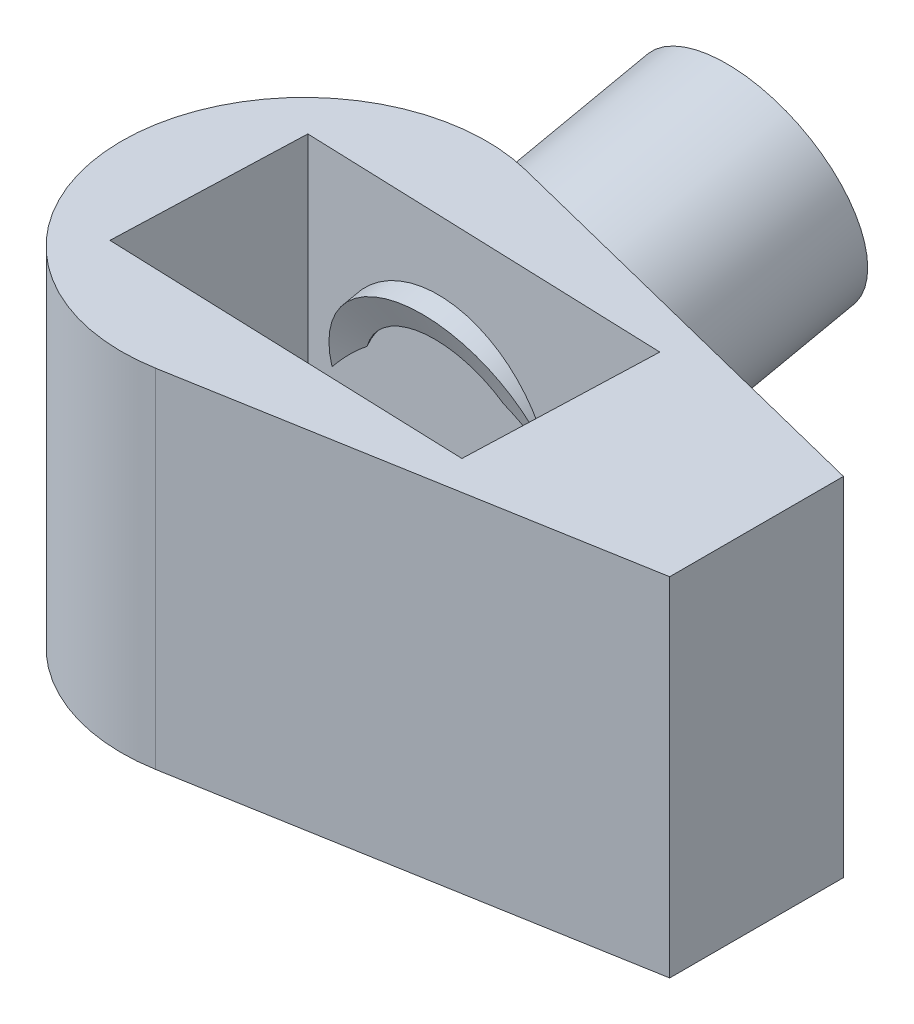
from build123d import *
from build123d.topology import SkipClean

# Parameters (mm, degrees)
CROQUIS1_R              = 21
SALIENTE_EXTRUIR1_DEPTH = 40
SALIENTE_EXTRUIR2_DEPTH = 40
SALIENTE_EXTRUIR3_REACH = 77.493
CROQUIS3_R              = 13.5
CROQUIS3_R_2            = 10
CROQUIS7_R              = 8.227269221
CROQUIS7_R_2            = 6
CORTAR_EXTRUIR6_DEPTH   = 6
CROQUIS8_R              = 6
CORTAR_EXTRUIR7_DEPTH   = 72.223648425
CORTAR_EXTRUIR8_START   = -25
CORTAR_EXTRUIR8_DEPTH   = 25
CROQUIS12_R             = 9.55
CORTAR_EXTRUIR9_DEPTH   = 5.5
CORTAR_EXTRUIR10_DEPTH  = 72.223648425


with BuildPart() as part:
    # Croquis1 → Saliente-Extruir1 (new body)
    with BuildSketch(Plane(origin=(0, 0, 0), x_dir=(1, 0, 0), z_dir=(0, 1, 0))):
        with Locations(Location((0, 0, 0), (0, 0, 270))):
            Circle(CROQUIS1_R)
    extrude(amount=SALIENTE_EXTRUIR1_DEPTH)

    # Croquis2 → Saliente-Extruir2 (add)
    with BuildSketch(Plane(origin=(0, 0, 0), x_dir=(1, 0, 0), z_dir=(0, 1, 0))):
        with BuildLine():
            Line((53.975127576, 8.110971331), (53.975127576, -11.889028669))
            Line((53.975127576, -11.889028669), (3.613793412, -20.686722727))
            ThreePointArc((3.613793412, -20.686722727), (20.98607707, -0.764571273), (5.109545014, 20.368911354))
            Line((5.109545014, 20.368911354), (53.975127576, 8.110971331))
        make_face()
    extrude(amount=SALIENTE_EXTRUIR2_DEPTH)

    # Croquis3 → Saliente-Extruir3 (add, up to next)
    with BuildSketch(Plane(origin=(5.109545014, 0, -20.368911354), x_dir=(-0.9699481597219111, 0, -0.24331166731597212), z_dir=(0.2433116673159721, 0, -0.969948159721911)), mode=Mode.PRIVATE) as saliente_extruir3_sk1:
        with Locations((0, 20)):
            Circle(CROQUIS3_R)
        with Locations((0, 20)):
            Circle(CROQUIS3_R_2, mode=Mode.SUBTRACT)
    saliente_extruir3_tool1 = extrude(saliente_extruir3_sk1.sketch, amount=-SALIENTE_EXTRUIR3_REACH, mode=Mode.PRIVATE) - part.part
    add(saliente_extruir3_tool1.solids().sort_by_distance((17.833482, 20, -17.177109))[0])

    # Croquis7 → Cortar-Extruir6 (cut)
    with BuildSketch(Plane.XZ):
        with Locations(Location((0, 0, 0), (0, 0, 270))):
            Circle(CROQUIS7_R)
        with Locations(Location((0, 0, 0), (0, 0, 270))):
            Circle(CROQUIS7_R_2, mode=Mode.SUBTRACT)
    extrude(amount=-CORTAR_EXTRUIR6_DEPTH, mode=Mode.SUBTRACT)

    # Croquis8 → Cortar-Extruir7 (cut, through all)
    with BuildSketch(Plane.XZ):
        with Locations(Location((0, 0, 0), (0, 0, 270))):
            Circle(CROQUIS8_R)
    extrude(amount=-CORTAR_EXTRUIR7_DEPTH, mode=Mode.SUBTRACT)

    # Croquis10 → Cortar-Extruir8 (cut)
    with BuildSketch(Plane(origin=(0, 40, 0), x_dir=(1, 0, 0), z_dir=(0, 1, 0)).offset(CORTAR_EXTRUIR8_START)):
        with BuildLine():
            Line((-5.995438853, 0.23390802), (-11.37823559, 0.424457107))
            Line((-11.37823559, 0.424457107), (-11.767631672, -10.575542893))
            Line((-11.767631672, -10.575542893), (30.232368328, -12.062327932))
            Line((30.232368328, -12.062327932), (30.62176441, -1.062327932))
            Line((30.62176441, -1.062327932), (5.996971268, -0.190619027))
            ThreePointArc((5.996971268, -0.190619027), (-0.212264906, -5.996244125), (-5.995438853, 0.23390802))
        make_face()
        with BuildLine():
            Line((-10.988839509, 11.424457107), (-11.37823559, 0.424457107))
            Line((-11.37823559, 0.424457107), (-5.995438853, 0.23390802))
            ThreePointArc((-5.995438853, 0.23390802), (0.116976243, 5.998859605), (6, 0))
            ThreePointArc((6, 0), (5.999242769, -0.095321543), (5.996971268, -0.190619027))
            Line((5.996971268, -0.190619027), (30.62176441, -1.062327932))
            Line((30.62176441, -1.062327932), (31.011160491, 9.937672068))
            Line((31.011160491, 9.937672068), (-10.988839509, 11.424457107))
        make_face()
    extrude(amount=CORTAR_EXTRUIR8_DEPTH, mode=Mode.SUBTRACT)

    # Croquis12 → Cortar-Extruir9 (cut)
    with BuildSketch(Plane(origin=(0, 15, 0), x_dir=(1, 0, 0), z_dir=(0, 1, 0))):
        with Locations(Location((0, 0, 0), (0, 0, 270))):
            Circle(CROQUIS12_R)
    extrude(amount=-CORTAR_EXTRUIR9_DEPTH, mode=Mode.SUBTRACT)

    # Croquis17 → Cortar-Extruir10 (cut, through all)
    with BuildSketch(Plane(origin=(0, 40, 0), x_dir=(1, 0, 0), z_dir=(0, 1, 0))):
        with BuildLine():
            Line((5.109545014, 20.368911354), (5.109545014, 31.680559043))
            Line((5.109545014, 31.680559043), (-13.688349404, 31.680559043))
            Line((-13.688349404, 31.680559043), (-13.688349404, 15.925736736))
            ThreePointArc((-13.688349404, 15.925736736), (-4.830571536, 20.436868122), (5.109545014, 20.368911354))
        make_face()
    extrude(amount=-CORTAR_EXTRUIR10_DEPTH, mode=Mode.SUBTRACT)

    # Croquis4 → Revolución1 (revolve)
    with SkipClean():  # the faces are left unmerged after this step: merging them gives an invalid solid
        with BuildSketch(Plane(origin=(5.1, 0, 0), x_dir=(0, 0, -1), z_dir=(1, 0, 0))):
            Polygon((13.998733147, 5.708275528), (49.038401492, 13.163524112), (49.038401492, 16.663524112), (20.838401492, 10.663524112), (13.998733147, 9.208275528), align=None)
        revolve(axis=Axis((5.1, 20.663524112, -20.838401492), (0, 0.20810764446485977, -0.9781059289848353)))


solid = part.part
